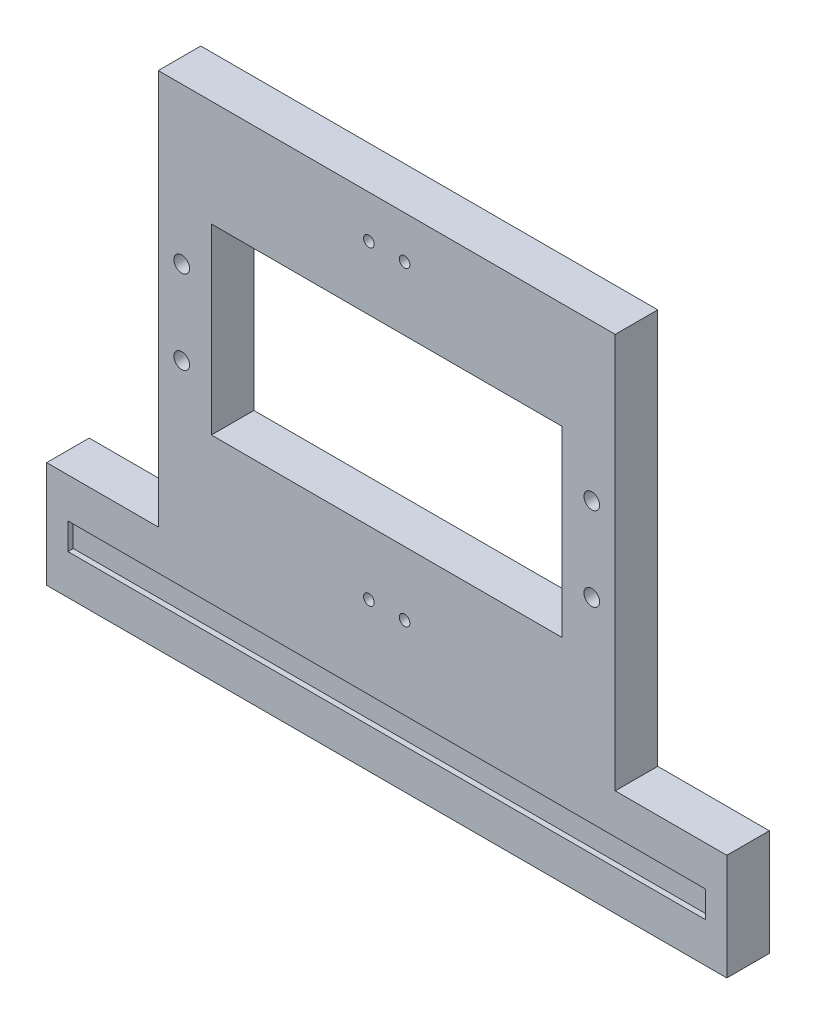
from build123d import *

# Parameters (mm, degrees)
SKETCH1_W           = 54.61
SKETCH1_H           = 47.244
SKETCH1_W_2         = 41.91
SKETCH1_H_2         = 21.844
BOSS_EXTRUDE1_DEPTH = 5.08
SKETCH2_R           = 0.93599
SKETCH2_R_2         = 0.635
CUT_EXTRUDE1_DEPTH  = 73.388217522
BOSS_EXTRUDE3_DEPTH = 5.08
SKETCH9_W           = 76.2
SKETCH9_H           = 3.175
CUT_EXTRUDE2_DEPTH  = 0.635


with BuildPart() as part:
    # Sketch1 → Boss-Extrude1 (new body)
    with BuildSketch(Plane.XY):
        with Locations((27.305, 23.622)):
            Rectangle(SKETCH1_W, SKETCH1_H)
        with Locations((27.305, 23.622)):
            Rectangle(SKETCH1_W_2, SKETCH1_H_2, mode=Mode.SUBTRACT)
    extrude(amount=BOSS_EXTRUDE1_DEPTH)

    # Sketch2 → Cut-Extrude1 (cut, through all)
    with BuildSketch(Plane.XY.offset(5.08)):
        with Locations((2.80543, 28.62199)):
            Circle(SKETCH2_R)
        with Locations((2.80543, 18.62201)):
            Circle(SKETCH2_R)
        with Locations((51.80457, 28.62199)):
            Circle(SKETCH2_R)
        with Locations((51.80457, 18.62201)):
            Circle(SKETCH2_R)
        with Locations((25.17521, 5.08)):
            Circle(SKETCH2_R_2)
        with Locations((29.43479, 5.08)):
            Circle(SKETCH2_R_2)
        with Locations((29.43479, 42.164)):
            Circle(SKETCH2_R_2)
        with Locations((25.17521, 42.164)):
            Circle(SKETCH2_R_2)
    extrude(amount=-CUT_EXTRUDE1_DEPTH, mode=Mode.SUBTRACT)

    # Sketch8 → Boss-Extrude3 (add)
    with BuildSketch(Plane.XY.offset(5.08)):
        Polygon((0, 0), (-13.335, 0), (-13.335, -12.7), (67.945, -12.7), (67.945, 0), (54.61, 0), align=None)
    extrude(amount=-BOSS_EXTRUDE3_DEPTH)

    # Sketch9 → Cut-Extrude2 (cut)
    with BuildSketch(Plane.XY.offset(5.08)):
        with Locations((27.305, -6.35)):
            Rectangle(SKETCH9_W, SKETCH9_H)
    extrude(amount=-CUT_EXTRUDE2_DEPTH, mode=Mode.SUBTRACT)


solid = part.part
